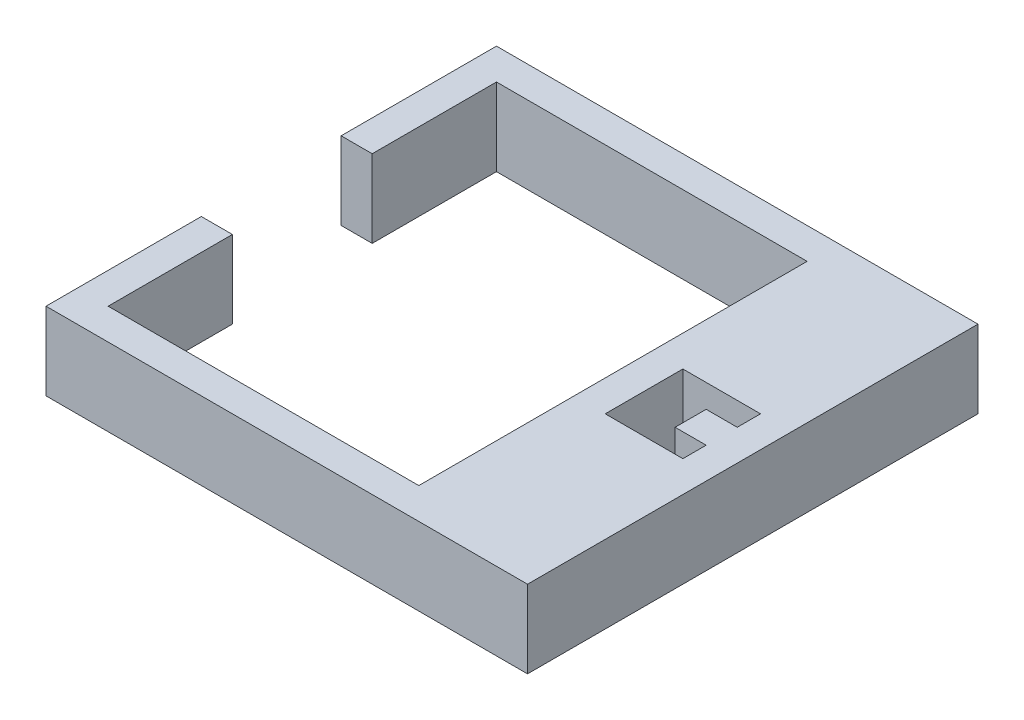
from build123d import *

# Parameters (mm, degrees)
BOSS_EXTRUDE2_DEPTH = 50


with BuildPart() as part:
    # Sketch1 → Boss-Extrude2 (new body)
    with BuildSketch(Plane(origin=(0, 0, 0), x_dir=(1, 0, 0), z_dir=(0, 1, 0))):
        Polygon((46.062322946, 141.388101983), (-263.937677054, 141.388101983), (-263.937677054, 41.388101983), (-243.937677054, 41.388101983), (-243.937677054, 121.388101983), (-43.937677054, 121.388101983), (-43.937677054, -128.611898017), (-243.937677054, -128.611898017), (-243.937677054, -48.611898017), (-263.937677054, -48.611898017), (-263.937677054, -148.611898017), (46.062322946, -148.611898017), align=None)
        Polygon((26.062322946, -28.611898017), (-23.937677054, -28.611898017), (-23.937677054, 21.388101983), (26.062322946, 21.388101983), (26.062322946, 6.388101983), (6.062322946, 6.388101983), (6.062322946, -13.611898017), (26.062322946, -13.611898017), align=None, mode=Mode.SUBTRACT)
    extrude(amount=BOSS_EXTRUDE2_DEPTH)


solid = part.part
